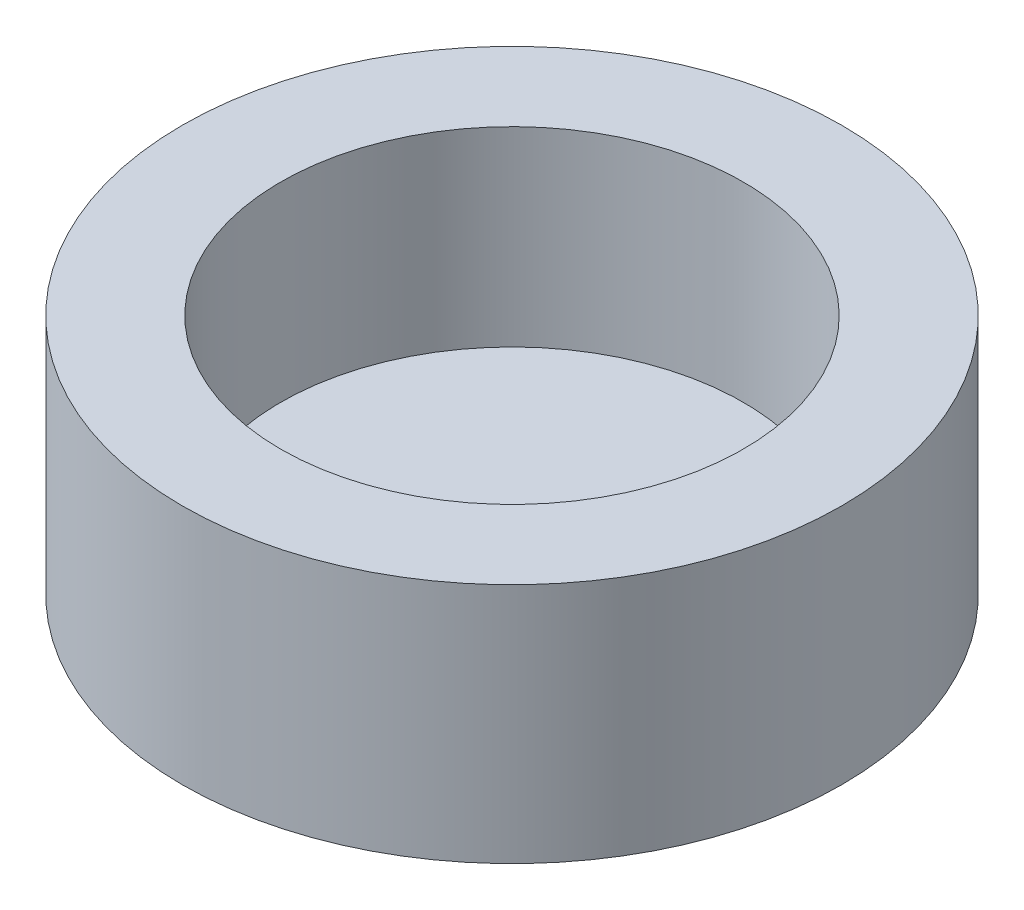
from build123d import *

# Parameters (mm, degrees)
SKETCH1_R           = 34.671
BOSS_EXTRUDE2_DEPTH = 25.4
SKETCH5_R           = 24.331541544
CUT_EXTRUDE2_DEPTH  = 20.066


with BuildPart() as part:
    # Sketch1 → Boss-Extrude2 (new body)
    with BuildSketch(Plane(origin=(0, 0, 0), x_dir=(1, 0, 0), z_dir=(0, 1, 0))):
        with Locations(Location((0, 0, 0), (0, 0, 270))):
            Circle(SKETCH1_R)
    extrude(amount=BOSS_EXTRUDE2_DEPTH)

    # Sketch5 → Cut-Extrude2 (cut)
    with BuildSketch(Plane(origin=(0, 25.4, 0), x_dir=(1, 0, 0), z_dir=(0, 1, 0))):
        with Locations(Location((0, 0, 0), (0, 0, 270))):
            Circle(SKETCH5_R)
    extrude(amount=-CUT_EXTRUDE2_DEPTH, mode=Mode.SUBTRACT)


solid = part.part
